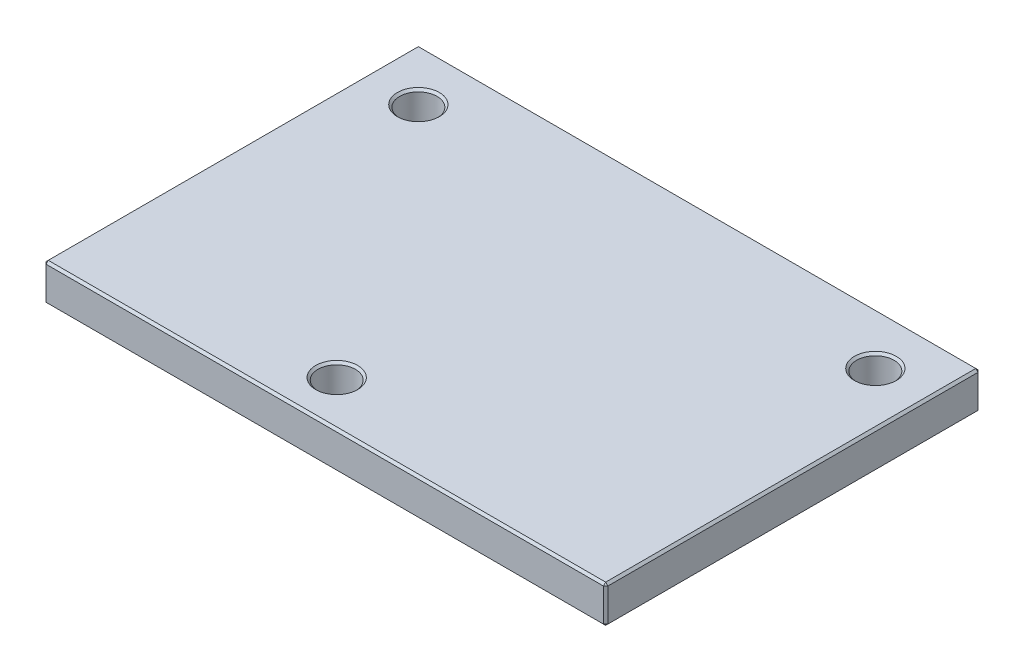
from build123d import *

# Parameters (mm, degrees)
SKETCH1_W           = 750
SKETCH1_H           = 500
BOSS_EXTRUDE1_DEPTH = 50
CUT_EXTRUDE1_REACH  = 455.459
SKETCH2_R           = 25
CHAMFER1_SIZE       = 3
CHAMFER2_SIZE       = 3


with BuildPart() as part:
    # Sketch1 → Boss-Extrude1 (new body)
    with BuildSketch(Plane(origin=(0, 0, 0), x_dir=(1, 0, 0), z_dir=(0, 1, 0))):
        Rectangle(SKETCH1_W, SKETCH1_H)
    extrude(amount=-BOSS_EXTRUDE1_DEPTH)

    # Sketch2 → Cut-Extrude1 (cut, up to next)
    with BuildSketch(Plane(origin=(0, 0, 0), x_dir=(1, 0, 0), z_dir=(0, 1, 0)), mode=Mode.PRIVATE) as cut_extrude1_sk1:
        with Locations(Location((-305, 180, 0), (0, 0, 270))):
            Circle(SKETCH2_R)
    cut_extrude1_tool1 = extrude(cut_extrude1_sk1.sketch, amount=-CUT_EXTRUDE1_REACH, mode=Mode.PRIVATE) & part.part
    # Sketch2 → Cut-Extrude1 (cut, up to next)
    with BuildSketch(Plane(origin=(0, 0, 0), x_dir=(1, 0, 0), z_dir=(0, 1, 0)), mode=Mode.PRIVATE) as cut_extrude1_sk2:
        with Locations(Location((305, 180, 0), (0, 0, 270))):
            Circle(SKETCH2_R)
    cut_extrude1_tool2 = extrude(cut_extrude1_sk2.sketch, amount=-CUT_EXTRUDE1_REACH, mode=Mode.PRIVATE) & part.part
    # Sketch2 → Cut-Extrude1 (cut, up to next)
    with BuildSketch(Plane(origin=(0, 0, 0), x_dir=(1, 0, 0), z_dir=(0, 1, 0)), mode=Mode.PRIVATE) as cut_extrude1_sk3:
        with Locations(Location((-44, -190, 0), (0, 0, 270))):
            Circle(SKETCH2_R)
    cut_extrude1_tool3 = extrude(cut_extrude1_sk3.sketch, amount=-CUT_EXTRUDE1_REACH, mode=Mode.PRIVATE) & part.part
    add(cut_extrude1_tool1.solids().sort_by_distance((-305, 0, -180))[0], mode=Mode.SUBTRACT)
    add(cut_extrude1_tool2.solids().sort_by_distance((305, 0, -180))[0], mode=Mode.SUBTRACT)
    add(cut_extrude1_tool3.solids().sort_by_distance((-44, 0, 190))[0], mode=Mode.SUBTRACT)

    # Chamfer1
    chamfer1_edges = [part.edges().sort_by_distance(p)[0] for p in [
        (-305, -50, -205),
        (-305, 0, -205),
        (305, -50, -205),
        (305, 0, -205),
        (-44, -50, 165),
        (-44, 0, 165),
    ]]
    chamfer(chamfer1_edges, length=CHAMFER1_SIZE)

    # Chamfer2
    chamfer2_edges = [part.edges().sort_by_distance(p)[0] for p in [
        (-375, -50, 0),
        (0, -50, 250),
        (375, -50, 0),
        (0, 0, 250),
        (-375, 0, 0),
        (0, 0, -250),
        (375, 0, 0),
        (375, -25, 250),
        (-375, -25, 250),
        (-375, -25, -250),
        (375, -25, -250),
        (0, -50, -250),
    ]]
    chamfer(chamfer2_edges, length=CHAMFER2_SIZE)


solid = part.part
